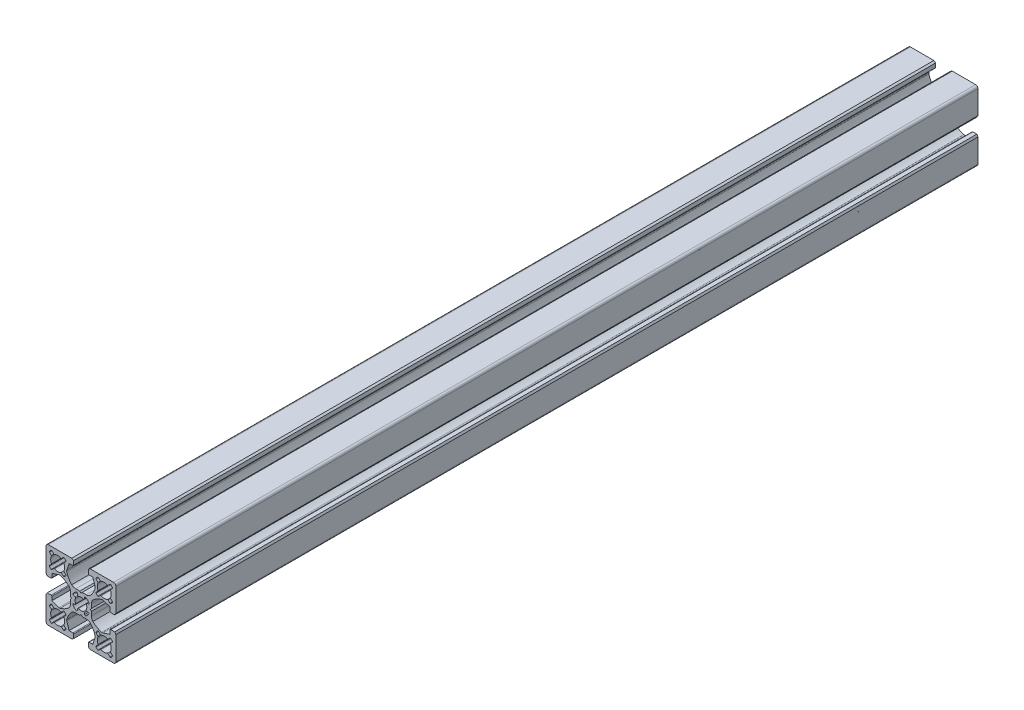
from build123d import *

# Parameters (mm, degrees)
EXTRUDE_1_DEPTH = 370


with BuildPart() as part:
    # Model → 보스-돌출1 (new body)
    with BuildSketch(Plane.XY):
        with BuildLine():
            Line((459.574175407, 182.783831091), (458.774175407, 183.283831091))
            Line((458.774175407, 183.283831091), (458.774175407, 184.983831091))
            ThreePointArc((458.774175407, 184.983831091), (458.862043373, 185.195963125), (459.074175407, 185.283831091))
            Line((459.074175407, 185.283831091), (460.724175407, 185.283831091))
            Line((460.724175407, 185.283831091), (461.711783237, 188.335604532))
            ThreePointArc((461.711783237, 188.335604532), (461.759141443, 188.594081667), (461.737530794, 188.855971354))
            ThreePointArc((461.737530794, 188.855971354), (460.898837663, 190.893750972), (459.628188183, 192.694140329))
            ThreePointArc((459.628188183, 192.694140329), (458.78251429, 193.132596412), (457.842016473, 193.283831091))
            Line((457.842016473, 193.283831091), (456.124175407, 193.283831091))
            Line((456.124175407, 193.283831091), (455.624175407, 193.783831091))
            Line((455.624175407, 193.783831091), (455.124175407, 193.283831091))
            Line((455.124175407, 193.283831091), (453.406334341, 193.283831091))
            ThreePointArc((453.406334341, 193.283831091), (452.465836525, 193.132596412), (451.620162632, 192.694140329))
            ThreePointArc((451.620162632, 192.694140329), (450.349513151, 190.893750972), (449.510820021, 188.855971354))
            ThreePointArc((449.510820021, 188.855971354), (449.489209372, 188.594081667), (449.536567578, 188.335604532))
            Line((449.536567578, 188.335604532), (450.524175407, 185.283831091))
            Line((450.524175407, 185.283831091), (452.174175407, 185.283831091))
            ThreePointArc((452.174175407, 185.283831091), (452.386307442, 185.195963125), (452.474175407, 184.983831091))
            Line((452.474175407, 184.983831091), (452.474175407, 183.283831091))
            Line((452.474175407, 183.283831091), (451.674175407, 182.783831091))
            Line((451.674175407, 182.783831091), (441.624175407, 182.783831091))
            ThreePointArc((441.624175407, 182.783831091), (440.917068626, 183.076724309), (440.624175407, 183.783831091))
            Line((440.624175407, 183.783831091), (440.624175407, 193.833831091))
            Line((440.624175407, 193.833831091), (441.124175407, 194.633831091))
            Line((441.124175407, 194.633831091), (442.824175407, 194.633831091))
            ThreePointArc((442.824175407, 194.633831091), (443.036307442, 194.545963125), (443.124175407, 194.333831091))
            Line((443.124175407, 194.333831091), (443.124175407, 192.683831091))
            Line((443.124175407, 192.683831091), (446.175948849, 191.696223261))
            ThreePointArc((446.175948849, 191.696223261), (446.434425983, 191.648865055), (446.696315671, 191.670475704))
            ThreePointArc((446.696315671, 191.670475704), (448.734095289, 192.509168835), (450.534484646, 193.779818315))
            ThreePointArc((450.534484646, 193.779818315), (450.972940729, 194.625492208), (451.124175407, 195.565990025))
            Line((451.124175407, 195.565990025), (451.124175407, 197.283831091))
            Line((451.124175407, 197.283831091), (451.624175407, 197.783831091))
            Line((451.624175407, 197.783831091), (451.124175407, 198.283831091))
            Line((451.124175407, 198.283831091), (451.124175407, 200.001672157))
            ThreePointArc((451.124175407, 200.001672157), (450.972940729, 200.942169973), (450.534484646, 201.787843866))
            ThreePointArc((450.534484646, 201.787843866), (448.734095289, 203.058493347), (446.696315671, 203.897186477))
            ThreePointArc((446.696315671, 203.897186477), (446.434425983, 203.918797126), (446.175948849, 203.87143892))
            Line((446.175948849, 203.87143892), (443.124175407, 202.883831091))
            Line((443.124175407, 202.883831091), (443.124175407, 201.233831091))
            ThreePointArc((443.124175407, 201.233831091), (443.036307442, 201.021699056), (442.824175407, 200.933831091))
            Line((442.824175407, 200.933831091), (441.124175407, 200.933831091))
            Line((441.124175407, 200.933831091), (440.624175407, 201.733831091))
            Line((440.624175407, 201.733831091), (440.624175407, 211.783831091))
            ThreePointArc((440.624175407, 211.783831091), (440.917068626, 212.490937872), (441.624175407, 212.783831091))
            Line((441.624175407, 212.783831091), (451.674175407, 212.783831091))
            Line((451.674175407, 212.783831091), (452.474175407, 212.283831091))
            Line((452.474175407, 212.283831091), (452.474175407, 210.583831091))
            ThreePointArc((452.474175407, 210.583831091), (452.386307442, 210.371699056), (452.174175407, 210.283831091))
            Line((452.174175407, 210.283831091), (450.524175407, 210.283831091))
            Line((450.524175407, 210.283831091), (449.536567578, 207.232057649))
            ThreePointArc((449.536567578, 207.232057649), (449.489209372, 206.973580515), (449.510820021, 206.711690827))
            ThreePointArc((449.510820021, 206.711690827), (450.349513151, 204.673911209), (451.620162632, 202.873521852))
            ThreePointArc((451.620162632, 202.873521852), (452.465836525, 202.435065769), (453.406334341, 202.283831091))
            Line((453.406334341, 202.283831091), (455.124175407, 202.283831091))
            Line((455.124175407, 202.283831091), (455.624175407, 201.783831091))
            Line((455.624175407, 201.783831091), (456.124175407, 202.283831091))
            Line((456.124175407, 202.283831091), (457.842016473, 202.283831091))
            ThreePointArc((457.842016473, 202.283831091), (458.78251429, 202.435065769), (459.628188183, 202.873521852))
            ThreePointArc((459.628188183, 202.873521852), (460.898837663, 204.673911209), (461.737530794, 206.711690827))
            ThreePointArc((461.737530794, 206.711690827), (461.759141443, 206.973580515), (461.711783237, 207.232057649))
            Line((461.711783237, 207.232057649), (460.724175407, 210.283831091))
            Line((460.724175407, 210.283831091), (459.074175407, 210.283831091))
            ThreePointArc((459.074175407, 210.283831091), (458.862043373, 210.371699056), (458.774175407, 210.583831091))
            Line((458.774175407, 210.583831091), (458.774175407, 212.283831091))
            Line((458.774175407, 212.283831091), (459.574175407, 212.783831091))
            Line((459.574175407, 212.783831091), (469.624175407, 212.783831091))
            ThreePointArc((469.624175407, 212.783831091), (470.331282189, 212.490937872), (470.624175407, 211.783831091))
            Line((470.624175407, 211.783831091), (470.624175407, 201.733831091))
            Line((470.624175407, 201.733831091), (470.124175407, 200.933831091))
            Line((470.124175407, 200.933831091), (468.424175407, 200.933831091))
            ThreePointArc((468.424175407, 200.933831091), (468.212043373, 201.021699056), (468.124175407, 201.233831091))
            Line((468.124175407, 201.233831091), (468.124175407, 202.883831091))
            Line((468.124175407, 202.883831091), (465.072401966, 203.87143892))
            ThreePointArc((465.072401966, 203.87143892), (464.813924831, 203.918797126), (464.552035144, 203.897186477))
            ThreePointArc((464.552035144, 203.897186477), (462.514255526, 203.058493347), (460.713866169, 201.787843866))
            ThreePointArc((460.713866169, 201.787843866), (460.275410086, 200.942169973), (460.124175407, 200.001672157))
            Line((460.124175407, 200.001672157), (460.124175407, 198.283831091))
            Line((460.124175407, 198.283831091), (459.624175407, 197.783831091))
            Line((459.624175407, 197.783831091), (460.124175407, 197.283831091))
            Line((460.124175407, 197.283831091), (460.124175407, 195.565990025))
            ThreePointArc((460.124175407, 195.565990025), (460.275410086, 194.625492208), (460.713866169, 193.779818315))
            ThreePointArc((460.713866169, 193.779818315), (462.514255526, 192.509168835), (464.552035144, 191.670475704))
            ThreePointArc((464.552035144, 191.670475704), (464.813924831, 191.648865055), (465.072401966, 191.696223261))
            Line((465.072401966, 191.696223261), (468.124175407, 192.683831091))
            Line((468.124175407, 192.683831091), (468.124175407, 194.333831091))
            ThreePointArc((468.124175407, 194.333831091), (468.212043373, 194.545963125), (468.424175407, 194.633831091))
            Line((468.424175407, 194.633831091), (470.124175407, 194.633831091))
            Line((470.124175407, 194.633831091), (470.624175407, 193.833831091))
            Line((470.624175407, 193.833831091), (470.624175407, 183.783831091))
            ThreePointArc((470.624175407, 183.783831091), (470.331282189, 183.076724309), (469.624175407, 182.783831091))
            Line((469.624175407, 182.783831091), (459.574175407, 182.783831091))
        make_face()
        with BuildLine():
            Line((462.879323242, 206.101978996), (462.138752469, 205.361408224))
            ThreePointArc((462.138752469, 205.361408224), (462.051316542, 205.165370796), (462.117245146, 204.961093696))
            ThreePointArc((462.117245146, 204.961093696), (462.439854993, 204.601850575), (462.799098114, 204.279240729))
            ThreePointArc((462.799098114, 204.279240729), (463.003375214, 204.213312125), (463.199412641, 204.300748052))
            Line((463.199412641, 204.300748052), (463.939983413, 205.041318824))
            ThreePointArc((463.939983413, 205.041318824), (464.103755722, 205.125263363), (464.285726362, 205.097790817))
            ThreePointArc((464.285726362, 205.097790817), (465.621835508, 204.783831091), (466.957944654, 205.097790817))
            ThreePointArc((466.957944654, 205.097790817), (467.139915294, 205.125263363), (467.303687603, 205.041318824))
            Line((467.303687603, 205.041318824), (468.044258375, 204.300748052))
            ThreePointArc((468.044258375, 204.300748052), (468.240295802, 204.213312125), (468.444572902, 204.279240729))
            ThreePointArc((468.444572902, 204.279240729), (468.803816023, 204.601850575), (469.12642587, 204.961093696))
            ThreePointArc((469.12642587, 204.961093696), (469.192354474, 205.165370796), (469.104918547, 205.361408224))
            Line((469.104918547, 205.361408224), (468.364347775, 206.101978996))
            ThreePointArc((468.364347775, 206.101978996), (468.280403236, 206.265751305), (468.307875782, 206.447721945))
            ThreePointArc((468.307875782, 206.447721945), (468.621835508, 207.783831091), (468.307875782, 209.119940236))
            ThreePointArc((468.307875782, 209.119940236), (468.280403236, 209.301910877), (468.364347774, 209.465683185))
            Line((468.364347774, 209.465683185), (469.104918547, 210.206253957))
            ThreePointArc((469.104918547, 210.206253957), (469.192354474, 210.402291385), (469.12642587, 210.606568485))
            ThreePointArc((469.12642587, 210.606568485), (468.803816023, 210.965811606), (468.444572902, 211.288421452))
            ThreePointArc((468.444572902, 211.288421452), (468.240295802, 211.354350057), (468.044258375, 211.266914129))
            Line((468.044258375, 211.266914129), (467.303687603, 210.526343357))
            ThreePointArc((467.303687603, 210.526343357), (467.139915294, 210.442398819), (466.957944654, 210.469871364))
            ThreePointArc((466.957944654, 210.469871364), (465.621835508, 210.783831091), (464.285726362, 210.469871364))
            ThreePointArc((464.285726362, 210.469871364), (464.103755722, 210.442398819), (463.939983413, 210.526343357))
            Line((463.939983413, 210.526343357), (463.199412641, 211.266914129))
            ThreePointArc((463.199412641, 211.266914129), (463.003375214, 211.354350057), (462.799098114, 211.288421452))
            ThreePointArc((462.799098114, 211.288421452), (462.439854993, 210.965811606), (462.117245146, 210.606568485))
            ThreePointArc((462.117245146, 210.606568485), (462.051316542, 210.402291385), (462.138752469, 210.206253957))
            Line((462.138752469, 210.206253957), (462.879323242, 209.465683185))
            ThreePointArc((462.879323242, 209.465683185), (462.96326778, 209.301910877), (462.935795235, 209.119940236))
            ThreePointArc((462.935795235, 209.119940236), (462.621835508, 207.783831091), (462.935795235, 206.447721945))
            ThreePointArc((462.935795235, 206.447721945), (462.96326778, 206.265751305), (462.879323242, 206.101978996))
        make_face(mode=Mode.SUBTRACT)
        with BuildLine():
            Line((462.878674407, 189.465117129), (462.138161401, 190.205745663))
            ThreePointArc((462.138161401, 190.205745663), (462.050740765, 190.40178991), (462.116685302, 190.606061867))
            ThreePointArc((462.116685302, 190.606061867), (462.439323169, 190.965279823), (462.798591452, 191.287861648))
            ThreePointArc((462.798591452, 191.287861648), (463.002873694, 191.353774318), (463.198904301, 191.2663231))
            Line((463.198904301, 191.2663231), (463.939417306, 190.525694566))
            ThreePointArc((463.939417306, 190.525694566), (464.103183067, 190.441737254), (464.285155849, 190.469195606))
            ThreePointArc((464.285155849, 190.469195606), (465.62128948, 190.783051115), (466.957374133, 190.468987173))
            ThreePointArc((466.957374133, 190.468987173), (467.13934263, 190.441500434), (467.303121485, 190.525432198))
            Line((467.303121485, 190.525432198), (468.04375002, 191.265945204))
            ThreePointArc((468.04375002, 191.265945204), (468.239794266, 191.35336584), (468.444066223, 191.287421303))
            ThreePointArc((468.444066223, 191.287421303), (468.80328418, 190.964783436), (469.125866004, 190.605515153))
            ThreePointArc((469.125866004, 190.605515153), (469.191778675, 190.401232911), (469.104327457, 190.205202304))
            Line((469.104327457, 190.205202304), (468.363698923, 189.464689299))
            ThreePointArc((468.363698923, 189.464689299), (468.27974161, 189.300923538), (468.307199962, 189.118950756))
            ThreePointArc((468.307199962, 189.118950756), (468.621055472, 187.782817125), (468.30699153, 186.446732472))
            ThreePointArc((468.30699153, 186.446732472), (468.279504791, 186.264763975), (468.363436555, 186.100985119))
            Line((468.363436555, 186.100985119), (469.103949561, 185.360356585))
            ThreePointArc((469.103949561, 185.360356585), (469.191370197, 185.164312338), (469.125425659, 184.960040382))
            ThreePointArc((469.125425659, 184.960040382), (468.802787793, 184.600822425), (468.443519509, 184.2782406))
            ThreePointArc((468.443519509, 184.2782406), (468.239237268, 184.21232793), (468.043206661, 184.299779148))
            Line((468.043206661, 184.299779148), (467.302693655, 185.040407682))
            ThreePointArc((467.302693655, 185.040407682), (467.138927895, 185.124364994), (466.956955112, 185.096906643))
            ThreePointArc((466.956955112, 185.096906643), (465.620821482, 184.783051133), (464.284736829, 185.097115075))
            ThreePointArc((464.284736829, 185.097115075), (464.102768332, 185.124601814), (463.938989476, 185.04067005))
            Line((463.938989476, 185.04067005), (463.198360942, 184.300157044))
            ThreePointArc((463.198360942, 184.300157044), (463.002316695, 184.212736408), (462.798044738, 184.278680946))
            ThreePointArc((462.798044738, 184.278680946), (462.438826782, 184.601318812), (462.116244957, 184.960587096))
            ThreePointArc((462.116244957, 184.960587096), (462.050332287, 185.164869337), (462.137783504, 185.360899944))
            Line((462.137783504, 185.360899944), (462.878412039, 186.10141295))
            ThreePointArc((462.878412039, 186.10141295), (462.962369351, 186.26517871), (462.934910999, 186.447151493))
            ThreePointArc((462.934910999, 186.447151493), (462.62105549, 187.783285123), (462.935119432, 189.119369776))
            ThreePointArc((462.935119432, 189.119369776), (462.962606171, 189.301338273), (462.878674407, 189.465117129))
        make_face(mode=Mode.SUBTRACT)
        with BuildLine():
            Line((448.367336509, 189.465117129), (449.107849514, 190.205745663))
            ThreePointArc((449.107849514, 190.205745663), (449.195270151, 190.40178991), (449.129325613, 190.606061867))
            ThreePointArc((449.129325613, 190.606061867), (448.806687747, 190.965279823), (448.447419463, 191.287861648))
            ThreePointArc((448.447419463, 191.287861648), (448.243137222, 191.353774318), (448.047106615, 191.2663231))
            Line((448.047106615, 191.2663231), (447.306593609, 190.525694566))
            ThreePointArc((447.306593609, 190.525694566), (447.142827848, 190.441737254), (446.960855066, 190.469195606))
            ThreePointArc((446.960855066, 190.469195606), (445.624721436, 190.783051115), (444.288636783, 190.468987173))
            ThreePointArc((444.288636783, 190.468987173), (444.106668286, 190.441500434), (443.94288943, 190.525432198))
            Line((443.94288943, 190.525432198), (443.202260896, 191.265945204))
            ThreePointArc((443.202260896, 191.265945204), (443.006216649, 191.35336584), (442.801944692, 191.287421303))
            ThreePointArc((442.801944692, 191.287421303), (442.442726735, 190.964783436), (442.120144911, 190.605515153))
            ThreePointArc((442.120144911, 190.605515153), (442.054232241, 190.401232911), (442.141683458, 190.205202304))
            Line((442.141683458, 190.205202304), (442.882311993, 189.464689299))
            ThreePointArc((442.882311993, 189.464689299), (442.966269305, 189.300923538), (442.938810953, 189.118950756))
            ThreePointArc((442.938810953, 189.118950756), (442.624955444, 187.782817125), (442.939019385, 186.446732472))
            ThreePointArc((442.939019385, 186.446732472), (442.966506124, 186.264763975), (442.88257436, 186.100985119))
            Line((442.88257436, 186.100985119), (442.142061355, 185.360356585))
            ThreePointArc((442.142061355, 185.360356585), (442.054640719, 185.164312338), (442.120585256, 184.960040382))
            ThreePointArc((442.120585256, 184.960040382), (442.443223122, 184.600822425), (442.802491406, 184.2782406))
            ThreePointArc((442.802491406, 184.2782406), (443.006773648, 184.21232793), (443.202804255, 184.299779148))
            Line((443.202804255, 184.299779148), (443.94331726, 185.040407682))
            ThreePointArc((443.94331726, 185.040407682), (444.107083021, 185.124364994), (444.289055803, 185.096906643))
            ThreePointArc((444.289055803, 185.096906643), (445.625189434, 184.783051133), (446.961274087, 185.097115075))
            ThreePointArc((446.961274087, 185.097115075), (447.143242583, 185.124601814), (447.307021439, 185.04067005))
            Line((447.307021439, 185.04067005), (448.047649974, 184.300157044))
            ThreePointArc((448.047649974, 184.300157044), (448.24369422, 184.212736408), (448.447966177, 184.278680946))
            ThreePointArc((448.447966177, 184.278680946), (448.807184134, 184.601318812), (449.129765958, 184.960587096))
            ThreePointArc((449.129765958, 184.960587096), (449.195678629, 185.164869337), (449.108227411, 185.360899944))
            Line((449.108227411, 185.360899944), (448.367598877, 186.10141295))
            ThreePointArc((448.367598877, 186.10141295), (448.283641564, 186.26517871), (448.311099916, 186.447151493))
            ThreePointArc((448.311099916, 186.447151493), (448.624955426, 187.783285123), (448.310891484, 189.119369776))
            ThreePointArc((448.310891484, 189.119369776), (448.283404745, 189.301338273), (448.367336509, 189.465117129))
        make_face(mode=Mode.SUBTRACT)
        with BuildLine():
            Line((457.210300672, 201.021172973), (457.076729929, 200.280239327))
            ThreePointArc((457.076729929, 200.280239327), (456.920864875, 200.06780508), (456.657491136, 200.060288559))
            ThreePointArc((456.657491136, 200.060288559), (455.624175407, 200.283831091), (454.590859679, 200.060288559))
            ThreePointArc((454.590859679, 200.060288559), (454.32748594, 200.06780508), (454.171620886, 200.280239327))
            Line((454.171620886, 200.280239327), (454.038050143, 201.021172973))
            ThreePointArc((454.038050143, 201.021172973), (453.867687152, 201.240722573), (453.590171174, 201.226215416))
            ThreePointArc((453.590171174, 201.226215416), (452.796918232, 200.611088266), (452.181791082, 199.817835324))
            ThreePointArc((452.181791082, 199.817835324), (452.167283925, 199.540319346), (452.386833525, 199.369956355))
            Line((452.386833525, 199.369956355), (453.127767171, 199.236385612))
            ThreePointArc((453.127767171, 199.236385612), (453.340201418, 199.080520558), (453.347717939, 198.817146819))
            ThreePointArc((453.347717939, 198.817146819), (453.124175407, 197.783831091), (453.347717939, 196.750515362))
            ThreePointArc((453.347717939, 196.750515362), (453.340201418, 196.487141623), (453.127767171, 196.331276569))
            Line((453.127767171, 196.331276569), (452.386833525, 196.197705826))
            ThreePointArc((452.386833525, 196.197705826), (452.167283925, 196.027342835), (452.181791082, 195.749826857))
            ThreePointArc((452.181791082, 195.749826857), (452.796918232, 194.956573915), (453.590171174, 194.341446765))
            ThreePointArc((453.590171174, 194.341446765), (453.867687152, 194.326939608), (454.038050143, 194.546489208))
            Line((454.038050143, 194.546489208), (454.171620886, 195.287422854))
            ThreePointArc((454.171620886, 195.287422854), (454.32748594, 195.499857101), (454.590859679, 195.507373622))
            ThreePointArc((454.590859679, 195.507373622), (455.624175407, 195.283831091), (456.657491136, 195.507373622))
            ThreePointArc((456.657491136, 195.507373622), (456.920864875, 195.499857101), (457.076729929, 195.287422854))
            Line((457.076729929, 195.287422854), (457.210300672, 194.546489208))
            ThreePointArc((457.210300672, 194.546489208), (457.380663663, 194.326939608), (457.658179641, 194.341446765))
            ThreePointArc((457.658179641, 194.341446765), (458.451432582, 194.956573915), (459.066559733, 195.749826857))
            ThreePointArc((459.066559733, 195.749826857), (459.08106689, 196.027342835), (458.86151729, 196.197705826))
            Line((458.86151729, 196.197705826), (458.120583644, 196.331276569))
            ThreePointArc((458.120583644, 196.331276569), (457.908149397, 196.487141623), (457.900632876, 196.750515362))
            ThreePointArc((457.900632876, 196.750515362), (458.124175407, 197.783831091), (457.900632876, 198.817146819))
            ThreePointArc((457.900632876, 198.817146819), (457.908149397, 199.080520558), (458.120583644, 199.236385612))
            Line((458.120583644, 199.236385612), (458.86151729, 199.369956355))
            ThreePointArc((458.86151729, 199.369956355), (459.08106689, 199.540319346), (459.066559733, 199.817835324))
            ThreePointArc((459.066559733, 199.817835324), (458.451432582, 200.611088266), (457.658179641, 201.226215416))
            ThreePointArc((457.658179641, 201.226215416), (457.380663663, 201.240722573), (457.210300672, 201.021172973))
        make_face(mode=Mode.SUBTRACT)
        with BuildLine():
            Line((448.366687674, 206.101978996), (449.107258446, 205.361408224))
            ThreePointArc((449.107258446, 205.361408224), (449.194694373, 205.165370796), (449.128765769, 204.961093696))
            ThreePointArc((449.128765769, 204.961093696), (448.806155923, 204.601850575), (448.446912802, 204.279240729))
            ThreePointArc((448.446912802, 204.279240729), (448.242635702, 204.213312125), (448.046598274, 204.300748052))
            Line((448.046598274, 204.300748052), (447.306027502, 205.041318824))
            ThreePointArc((447.306027502, 205.041318824), (447.142255193, 205.125263363), (446.960284553, 205.097790817))
            ThreePointArc((446.960284553, 205.097790817), (445.624175407, 204.783831091), (444.288066262, 205.097790817))
            ThreePointArc((444.288066262, 205.097790817), (444.106095621, 205.125263363), (443.942323313, 205.041318824))
            Line((443.942323313, 205.041318824), (443.20175254, 204.300748052))
            ThreePointArc((443.20175254, 204.300748052), (443.005715113, 204.213312125), (442.801438013, 204.279240729))
            ThreePointArc((442.801438013, 204.279240729), (442.442194892, 204.601850575), (442.119585046, 204.961093696))
            ThreePointArc((442.119585046, 204.961093696), (442.053656441, 205.165370796), (442.141092369, 205.361408224))
            Line((442.141092369, 205.361408224), (442.881663141, 206.101978996))
            ThreePointArc((442.881663141, 206.101978996), (442.965607679, 206.265751305), (442.938135134, 206.447721945))
            ThreePointArc((442.938135134, 206.447721945), (442.624175407, 207.783831091), (442.938135134, 209.119940236))
            ThreePointArc((442.938135134, 209.119940236), (442.965607679, 209.301910877), (442.881663141, 209.465683185))
            Line((442.881663141, 209.465683185), (442.141092369, 210.206253957))
            ThreePointArc((442.141092369, 210.206253957), (442.053656441, 210.402291385), (442.119585046, 210.606568485))
            ThreePointArc((442.119585046, 210.606568485), (442.442194892, 210.965811606), (442.801438013, 211.288421452))
            ThreePointArc((442.801438013, 211.288421452), (443.005715113, 211.354350057), (443.20175254, 211.266914129))
            Line((443.20175254, 211.266914129), (443.942323313, 210.526343357))
            ThreePointArc((443.942323313, 210.526343357), (444.106095621, 210.442398819), (444.288066262, 210.469871364))
            ThreePointArc((444.288066262, 210.469871364), (445.624175407, 210.783831091), (446.960284553, 210.469871364))
            ThreePointArc((446.960284553, 210.469871364), (447.142255193, 210.442398819), (447.306027502, 210.526343357))
            Line((447.306027502, 210.526343357), (448.046598274, 211.266914129))
            ThreePointArc((448.046598274, 211.266914129), (448.242635702, 211.354350056), (448.446912802, 211.288421452))
            ThreePointArc((448.446912802, 211.288421452), (448.806155923, 210.965811606), (449.128765769, 210.606568485))
            ThreePointArc((449.128765769, 210.606568485), (449.194694373, 210.402291385), (449.107258446, 210.206253957))
            Line((449.107258446, 210.206253957), (448.366687674, 209.465683185))
            ThreePointArc((448.366687674, 209.465683185), (448.282743135, 209.301910877), (448.310215681, 209.119940236))
            ThreePointArc((448.310215681, 209.119940236), (448.624175407, 207.783831091), (448.310215681, 206.447721945))
            ThreePointArc((448.310215681, 206.447721945), (448.282743135, 206.265751305), (448.366687674, 206.101978996))
        make_face(mode=Mode.SUBTRACT)
    extrude(amount=EXTRUDE_1_DEPTH)


solid = part.part
